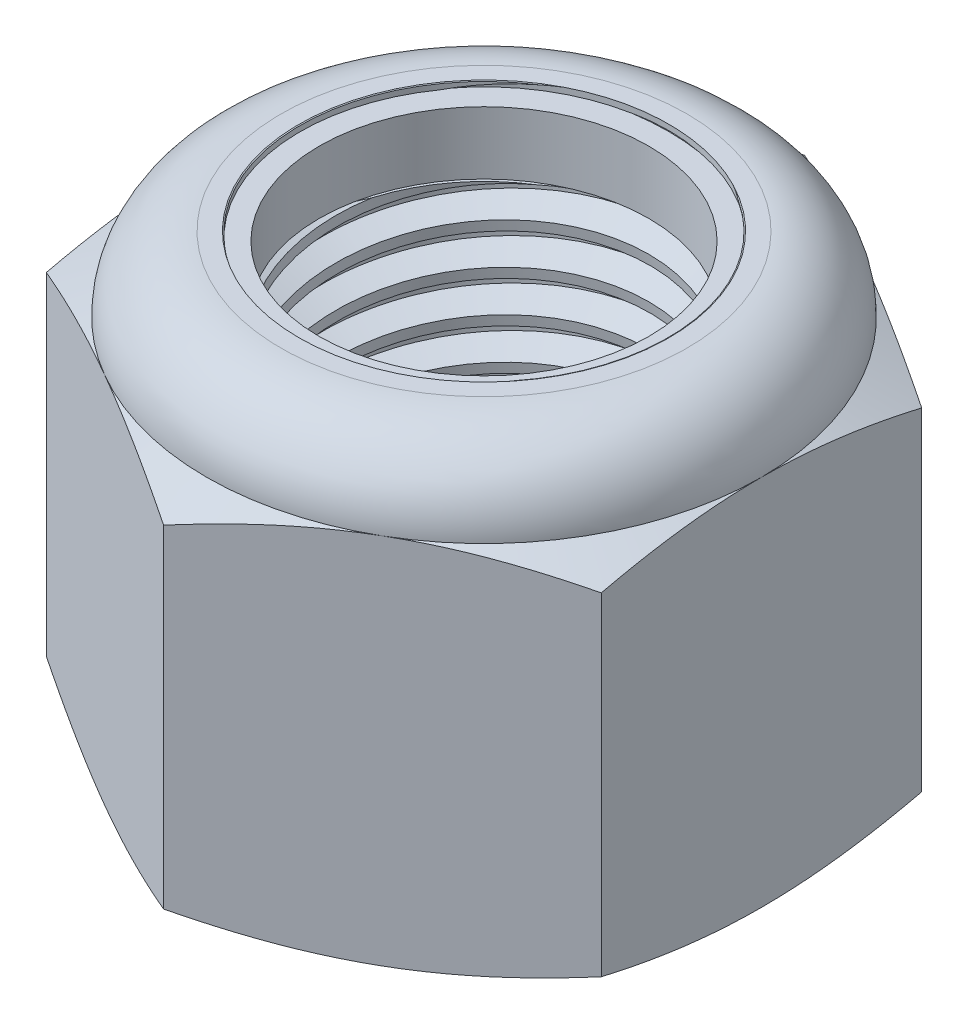
from build123d import *

# Parameters (mm, degrees)
EXTRUDE1_DEPTH      = 11.509375
SKETCH2_W           = 4.7625
SKETCH2_H           = 11.509375
LPATTERN1_COUNT     = 11
LPATTERN1_PITCH     = 1.058333333
LPATTERN1_COL_COUNT = 2
LPATTERN1_COL_PITCH = 1.058333333


with BuildPart() as part:
    # Sketch1 → Extrude1 (new body)
    with BuildSketch(Plane(origin=(0, 0, 0), x_dir=(1, 0, 0), z_dir=(0, 1, 0))):
        Polygon((0, 8.248891971), (-7.14375, 4.124445986), (-7.14375, -4.124445986), (0, -8.248891971), (7.14375, -4.124445986), (7.14375, 4.124445986), align=None)
    extrude(amount=EXTRUDE1_DEPTH)

    # Sketch4 → Cut-Revolve2 (revolve, cut)
    with BuildSketch(Plane(origin=(0, 0, 0), x_dir=(0, 0, -1), z_dir=(1, 0, 0)), mode=Mode.PRIVATE) as cut_revolve2_sk:
        Polygon((0, 11.509375), (4.7625, 11.509375), (4.244296017, 11.267732514), (4.244296017, 0.241642486), (4.7625, 0), (0, 0), align=None)
    revolve(cut_revolve2_sk.sketch.rotate(Axis((0, 11.509375, 0), (0, 1, 0)), 54.723003925), axis=Axis((0, 11.509375, 0), (0, 1, 0)), mode=Mode.SUBTRACT)


with BuildPart() as body_2:
    # Sketch2 → Revolve1 (revolve)
    with BuildSketch(Plane(origin=(0, 0, 0), x_dir=(0, 0, -1), z_dir=(1, 0, 0))):
        with Locations((2.38125, 5.7546875)):
            Rectangle(SKETCH2_W, SKETCH2_H)
    revolve(axis=Axis((0, -4.7625, 0), (0, 1, 0)))

    # Sketch3 → Cut-Revolve1 (revolve, cut)
    with BuildSketch(Plane(origin=(0, 0, 0), x_dir=(0, 0, -1), z_dir=(1, 0, 0)), mode=Mode.PRIVATE) as cut_revolve1_sk:
        Polygon((4.777109171, 11.377892464), (4.879373365, 10.457514714), (4.273514358, 10.722961489), (4.244296017, 10.98592656), align=None)
    cut_revolve1 = revolve(cut_revolve1_sk.sketch.rotate(Axis((0, 11.509375, 0.125349185), (0, -0.9938837346736189, -0.11043152607484685)), 180), axis=Axis((0, 11.509375, 0.125349185), (0, -0.9938837346736189, -0.11043152607484685)), mode=Mode.SUBTRACT)

    # LPattern1: Cut-Revolve1 ×11
    with Locations(*[(0, -i * LPATTERN1_PITCH, 0) for i in range(1, LPATTERN1_COUNT)]):
        add(cut_revolve1, mode=Mode.SUBTRACT)

    # LPattern1 col: Cut-Revolve1 ×2
    with Locations(*[(0, i * LPATTERN1_COL_PITCH, 0) for i in range(1, LPATTERN1_COL_COUNT)]):
        add(cut_revolve1, mode=Mode.SUBTRACT)


with BuildPart() as part_1:
    add(part.part)

    # Combine1: cut body 2
    add(body_2.part, mode=Mode.SUBTRACT)

    # Sketch5 → Cut-Revolve3 (revolve, cut)
    with BuildSketch(Plane(origin=(0, 0, 0), x_dir=(0, 0, -1), z_dir=(1, 0, 0)), mode=Mode.PRIVATE) as cut_revolve3_sk:
        with BuildLine():
            Line((0, 0), (7.14375, 0))
            Line((7.14375, 0), (8.248891971, 0.515336164))
            Line((8.248891971, 0.515336164), (8.248891971, 9.075809669))
            Line((8.248891971, 9.075809669), (7.14375, 9.591145833))
            ThreePointArc((7.14375, 9.591145833), (6.581913685, 10.947538685), (5.225520833, 11.509375))
            Line((5.225520833, 11.509375), (5.225520833, 12.779375))
            Line((5.225520833, 12.779375), (9.518891971, 12.779375))
            Line((9.518891971, 12.779375), (9.518891971, -1.27))
            Line((9.518891971, -1.27), (0, -1.27))
            Line((0, -1.27), (0, 0))
        make_face()
    revolve(cut_revolve3_sk.sketch.rotate(Axis((0, 0, 0), (0, 1, 0)), 54.723003925), axis=Axis((0, 0, 0), (0, 1, 0)), mode=Mode.SUBTRACT)

    # Sketch6 → Cut-Revolve4 (revolve, cut)
    with BuildSketch(Plane(origin=(0, 0, 0), x_dir=(0, 0, -1), z_dir=(1, 0, 0)), mode=Mode.PRIVATE) as cut_revolve4_sk:
        with BuildLine():
            Line((0, 9.591145833), (6.99135, 9.591145833))
            ThreePointArc((6.99135, 9.591145833), (6.474150612, 10.839775612), (5.225520833, 11.356975))
            Line((5.225520833, 11.356975), (4.734908425, 11.356975))
            Line((4.734908425, 11.356975), (4.734908425, 12.779375))
            Line((4.734908425, 12.779375), (0, 12.779375))
            Line((0, 12.779375), (0, 9.591145833))
        make_face()
    revolve(cut_revolve4_sk.sketch.rotate(Axis((0, 12.779375, 0), (0, 1, 0)), 54.723003925), axis=Axis((0, 12.779375, 0), (0, 1, 0)), mode=Mode.SUBTRACT)


with BuildPart() as body_2_2:
    # Sketch7 → Revolve2 (revolve)
    with BuildSketch(Plane(origin=(0, 0, 0), x_dir=(0, 0, -1), z_dir=(1, 0, 0)), mode=Mode.PRIVATE) as revolve2_sk:
        with BuildLine():
            Line((4.244296017, 9.667345833), (6.913430867, 9.667345833))
            ThreePointArc((6.913430867, 9.667345833), (6.39301751, 10.812537757), (5.225520833, 11.280775))
            Line((5.225520833, 11.280775), (4.244296017, 11.280775))
            Line((4.244296017, 11.280775), (4.244296017, 9.667345833))
        make_face()
    revolve(revolve2_sk.sketch.rotate(Axis((0, 9.667345833, 0), (0, 1, 0)), 54.723003925), axis=Axis((0, 9.667345833, 0), (0, 1, 0)))


solid = Compound([part_1.part, body_2_2.part])
